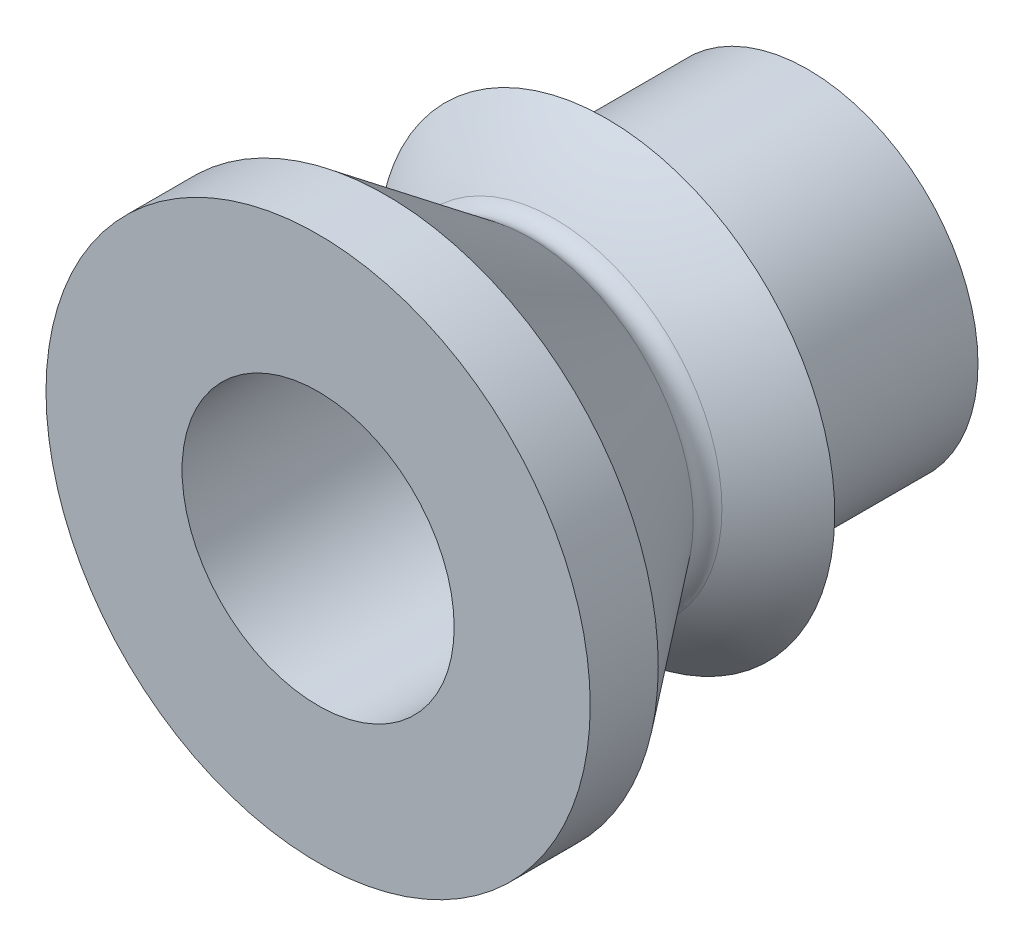
from build123d import *


with BuildPart() as part:
    # Sketch1 → Revolve1 (revolve)
    with BuildSketch(Plane(origin=(0, 0, 0), x_dir=(0, 0, -1), z_dir=(1, 0, 0)), mode=Mode.PRIVATE) as revolve1_sk:
        with BuildLine():
            Line((-0.127, 6.35), (-0.127, 7.9375))
            Line((-0.127, 7.9375), (-9.525, 7.9375))
            Line((-9.525, 7.9375), (-9.525, 10.649273743))
            ThreePointArc((-9.525, 10.649273743), (-10.834561548, 9.313695954), (-11.958424774, 7.818486629))
            ThreePointArc((-11.958424774, 7.818486629), (-12.487029733, 7.470791715), (-13.10188894, 7.62))
            Line((-13.10188894, 7.62), (-19.812, 12.7))
            Line((-19.812, 12.7), (-22.987, 12.7))
            Line((-22.987, 12.7), (-22.987, 6.35))
            Line((-22.987, 6.35), (-0.127, 6.35))
        make_face()
    revolve(revolve1_sk.sketch.rotate(Axis((0, 0, 47.275745838), (0, 0, -1)), 90), axis=Axis((0, 0, 47.275745838), (0, 0, -1)))


solid = part.part
